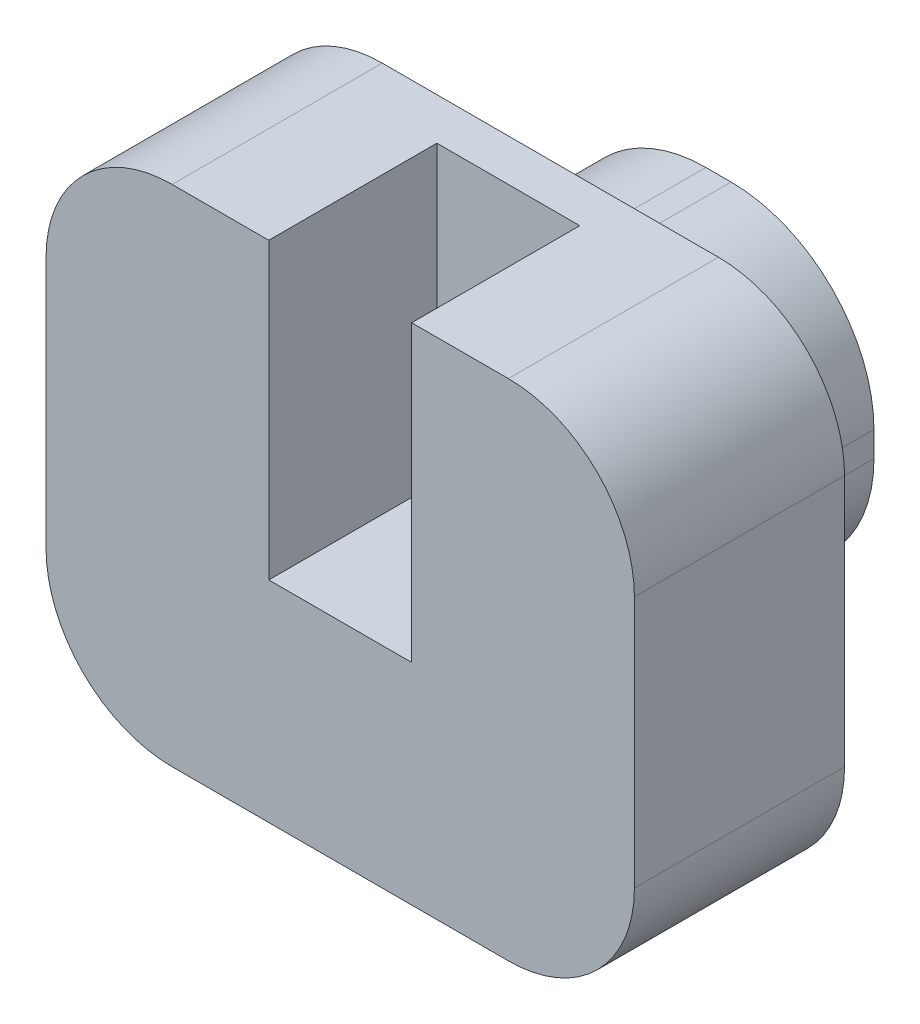
from build123d import *

# Parameters (mm, degrees)
EXTRUDE_1_DEPTH     = 2
EXTRUDE_2_DEPTH     = 2.5
SKETCH_4_W          = 1.7
SKETCH_4_H          = 2
CUT_EXTRUDE_1_DEPTH = 3.5


with BuildPart() as part:
    # Эскиз1 → Бобышка-Вытянуть1 (new body)
    with BuildSketch(Plane.XY):
        with BuildLine():
            Line((-0.15, -1.85), (0.15, -1.85))
            ThreePointArc((0.15, -1.85), (1.352081528, -1.352081528), (1.85, -0.15))
            Line((1.85, -0.15), (1.85, 0.15))
            ThreePointArc((1.85, 0.15), (1.352081528, 1.352081528), (0.15, 1.85))
            Line((0.15, 1.85), (-0.15, 1.85))
            ThreePointArc((-0.15, 1.85), (-1.352081528, 1.352081528), (-1.85, 0.15))
            Line((-1.85, 0.15), (-1.85, -0.15))
            ThreePointArc((-1.85, -0.15), (-1.352081528, -1.352081528), (-0.15, -1.85))
        make_face()
    extrude(amount=EXTRUDE_1_DEPTH)

    # Эскиз2 → Бобышка-Вытянуть2 (add)
    with BuildSketch(Plane.XY.offset(2)):
        with BuildLine():
            Line((-2, -3), (2, -3))
            ThreePointArc((2, -3), (3.060660172, -2.560660172), (3.5, -1.5))
            Line((3.5, -1.5), (3.5, 1.5))
            ThreePointArc((3.5, 1.5), (3.060660172, 2.560660172), (2, 3))
            Line((2, 3), (-2, 3))
            ThreePointArc((-2, 3), (-3.060660172, 2.560660172), (-3.5, 1.5))
            Line((-3.5, 1.5), (-3.5, -1.5))
            ThreePointArc((-3.5, -1.5), (-3.060660172, -2.560660172), (-2, -3))
        make_face()
    extrude(amount=EXTRUDE_2_DEPTH)

    # Эскиз4 → Вырез-Вытянуть1 (cut)
    with BuildSketch(Plane(origin=(0, 3, 0), x_dir=(1, 0, 0), z_dir=(0, 1, 0))):
        with Locations((0, -3.5)):
            Rectangle(SKETCH_4_W, SKETCH_4_H)
    extrude(amount=-CUT_EXTRUDE_1_DEPTH, mode=Mode.SUBTRACT)


solid = part.part
